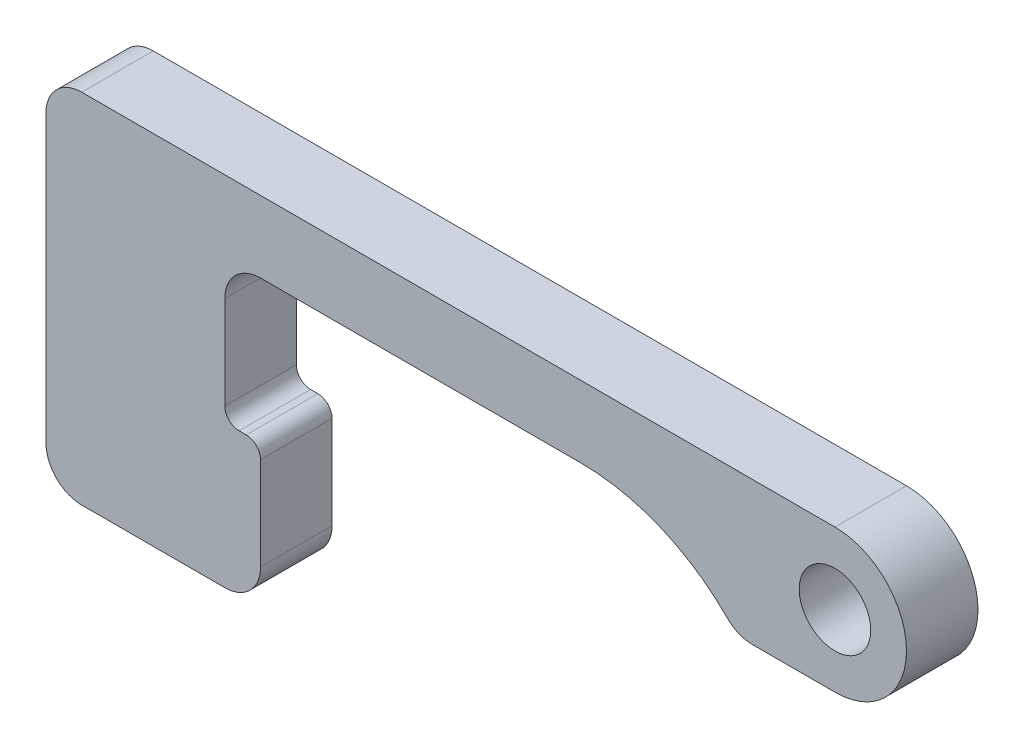
from build123d import *

# Parameters (mm, degrees)
SKETCH1_R           = 5
BOSS_EXTRUDE1_DEPTH = 10
FILLET1_R           = 5
FILLET2_R           = 2


with BuildPart() as part:
    # Sketch1 → Boss-Extrude1 (new body)
    with BuildSketch(Plane.XY):
        with BuildLine():
            Line((-80.316945701, -40), (-110.316945701, -40))
            Line((-110.316945701, -40), (-110.316945701, 10))
            Line((-110.316945701, 10), (0, 10))
            ThreePointArc((0, 10), (10, 0), (0, -10))
            Line((0, -10), (-13.703998561, -10))
            ThreePointArc((-13.703998561, -10), (-23.539034413, -2.618771092), (-35.553713283, 0))
            Line((-35.553713283, 0), (-85.316945701, 0))
            Line((-85.316945701, 0), (-85.316945701, -20))
            Line((-85.316945701, -20), (-80.316945701, -20))
            Line((-80.316945701, -20), (-80.316945701, -40))
        make_face()
        Circle(SKETCH1_R, mode=Mode.SUBTRACT)
    extrude(amount=BOSS_EXTRUDE1_DEPTH)

    # Fillet1
    fillet1_edges = [part.edges().sort_by_distance(p)[0] for p in [
        (-80.316945701, -40, 5),
        (-110.316945701, -40, 5),
        (-110.316945701, 10, 5),
        (-13.703998561, -10, 5),
        (-85.316945701, 0, 5),
    ]]
    fillet(fillet1_edges, radius=FILLET1_R)

    # Fillet2
    fillet2_edges = [part.edges().sort_by_distance(p)[0] for p in [
        (-85.316945701, -20, 5),
        (-80.316945701, -20, 5),
    ]]
    fillet(fillet2_edges, radius=FILLET2_R)


solid = part.part
